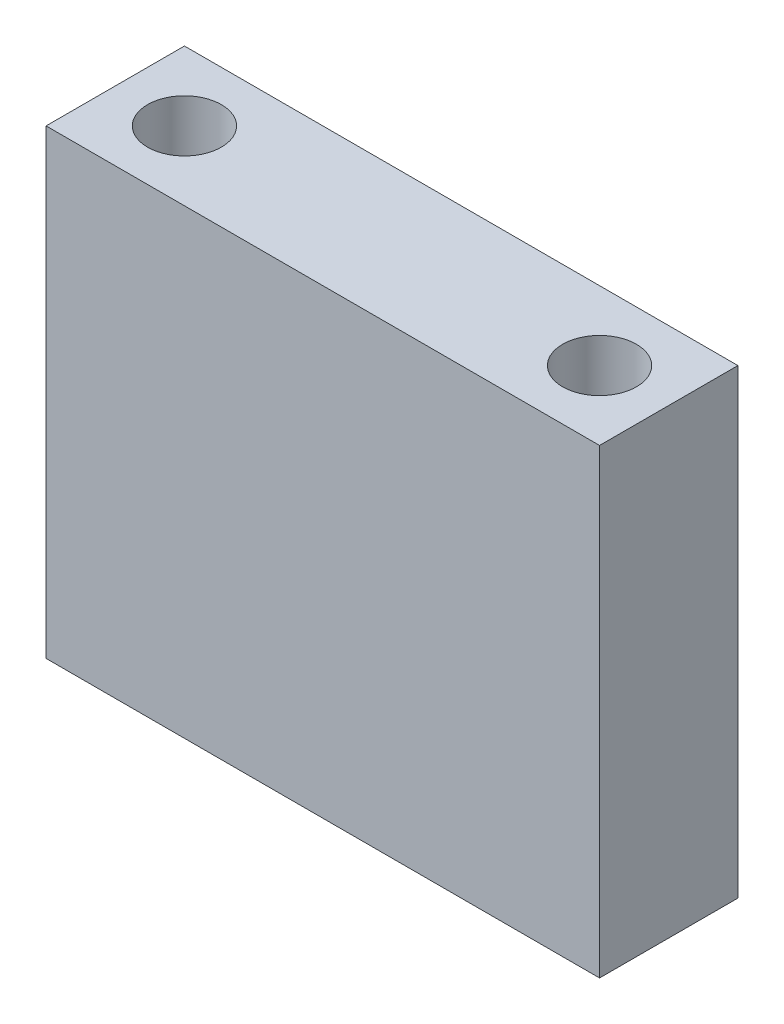
from build123d import *

# Parameters (mm, degrees)
SKETCH1_W                 = 38.1
SKETCH1_H                 = 31.75
BOSS_EXTRUDE1_DEPTH       = 9.525
F_6_32_TAPPED_HOLE1_D     = 2.7051
F_6_32_TAPPED_HOLE1_DEPTH = 7.62
F_6_32_TAPPED_HOLE1_TIP   = 0.81269403
F_6_32_TAPPED_HOLE2_D     = 2.7051
F_6_32_TAPPED_HOLE2_DEPTH = 9.38784
F_6_32_TAPPED_HOLE2_TIP   = 0.81269403
SKETCH2_R                 = 2.54
CUT_EXTRUDE1_DEPTH        = 39.232062788


with BuildPart() as part:
    # Sketch1 → Boss-Extrude1 (new body)
    with BuildSketch(Plane.XY):
        Rectangle(SKETCH1_W, SKETCH1_H)
    extrude(amount=BOSS_EXTRUDE1_DEPTH)

    # #6-32 Tapped Hole1
    with Locations(Plane(origin=(0, 15.875, 0), x_dir=(1, 0, 0), z_dir=(0, 1, 0))):
        with Locations((-14.2875, -4.7625), (14.2875, -4.7625)):
            Hole(F_6_32_TAPPED_HOLE1_D / 2, depth=F_6_32_TAPPED_HOLE1_DEPTH)
            with Locations((0, 0, -(F_6_32_TAPPED_HOLE1_DEPTH + F_6_32_TAPPED_HOLE1_TIP / 2))):  # 118° drill point
                Cone(0, F_6_32_TAPPED_HOLE1_D / 2, F_6_32_TAPPED_HOLE1_TIP, mode=Mode.SUBTRACT)

    # #6-32 Tapped Hole2
    with Locations(Plane(origin=(0, -15.875, 0), x_dir=(-1, 0, 0), z_dir=(0, -1, 0))):
        with Locations((-14.2875, -4.7625), (14.2875, -4.7625)):
            Hole(F_6_32_TAPPED_HOLE2_D / 2, depth=F_6_32_TAPPED_HOLE2_DEPTH)
            with Locations((0, 0, -(F_6_32_TAPPED_HOLE2_DEPTH + F_6_32_TAPPED_HOLE2_TIP / 2))):  # 118° drill point
                Cone(0, F_6_32_TAPPED_HOLE2_D / 2, F_6_32_TAPPED_HOLE2_TIP, mode=Mode.SUBTRACT)

    # Sketch2 → Cut-Extrude1 (cut, through all)
    with BuildSketch(Plane(origin=(0, 15.875, 0), x_dir=(1, 0, 0), z_dir=(0, 1, 0))):
        with Locations(Location((-14.2875, -4.7625, 0), (0, 0, 270))):
            Circle(SKETCH2_R)
        with Locations(Location((14.2875, -4.7625, 0), (0, 0, 270))):
            Circle(SKETCH2_R)
    extrude(amount=-CUT_EXTRUDE1_DEPTH, mode=Mode.SUBTRACT)


solid = part.part
